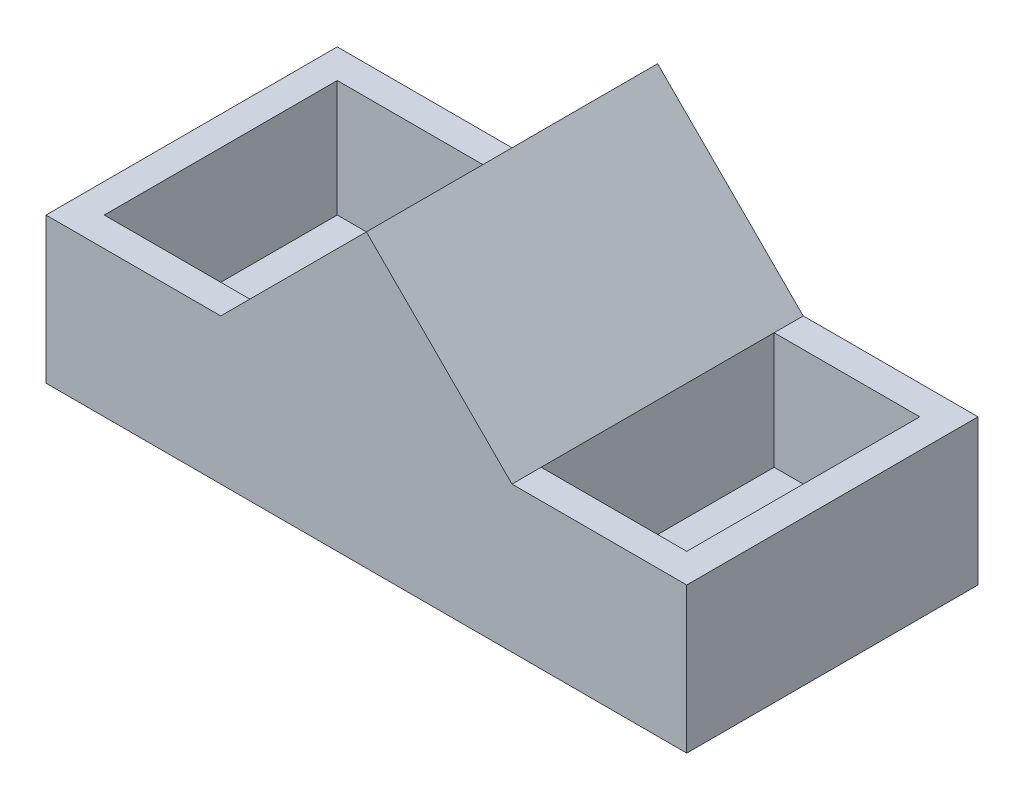
from build123d import *

# Parameters (mm, degrees)
BOSS_EXTRUDE1_DEPTH = 100
BOSS_EXTRUDE2_DEPTH = 50
SKETCH5_W           = 100
SKETCH5_H           = 50
BOSS_EXTRUDE3_DEPTH = 10


with BuildPart() as part:
    # Sketch2 → Boss-Extrude1 (new body)
    with BuildSketch(Plane.XY):
        Polygon((-50, 0), (50, 0), (50, 50), (0, 100), (-50, 50), align=None)
    extrude(amount=BOSS_EXTRUDE1_DEPTH)

    # Sketch4 → Boss-Extrude2 (add)
    with BuildSketch(Plane(origin=(50, 0, 0), x_dir=(0, 0, -1), z_dir=(1, 0, 0))):
        Polygon((-100, 50), (-100, 0), (0, 0), (0, 50), (-10, 50), (-10, 10), (-90, 10), (-90, 50), align=None)
    boss_extrude2 = extrude(amount=BOSS_EXTRUDE2_DEPTH)

    # Sketch5 → Boss-Extrude3 (add)
    with BuildSketch(Plane(origin=(100, 0, 0), x_dir=(0, 0, -1), z_dir=(1, 0, 0))):
        with Locations((-50, 25)):
            Rectangle(SKETCH5_W, SKETCH5_H)
    boss_extrude3 = extrude(amount=BOSS_EXTRUDE3_DEPTH)

    # Mirror1: Boss-Extrude2, Boss-Extrude3 across plane
    add(boss_extrude2.mirror(Plane(origin=(0, 0, 0), x_dir=(0, 0, 1), z_dir=(1, 0, 0))))
    add(boss_extrude3.mirror(Plane(origin=(0, 0, 0), x_dir=(0, 0, 1), z_dir=(1, 0, 0))))


solid = part.part
